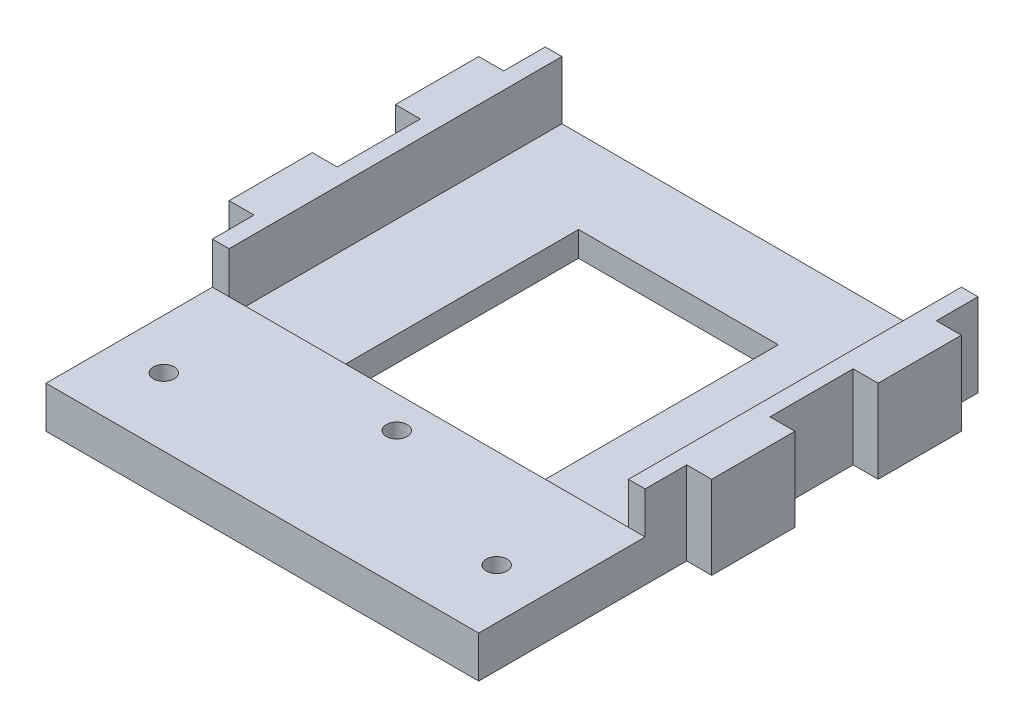
from build123d import *

# Parameters (mm, degrees)
SKETCH1_W               = 52
SKETCH1_H               = 60
BOSS_EXTRUDE1_DEPTH     = 10
CUT_EXTRUDE1_DEPTH      = 5
SKETCH3_R               = 1.25
CUT_EXTRUDE2_DEPTH      = 5
CUT_EXTRUDE3_DEPTH      = 3
SKETCH6_W               = 24
SKETCH6_H               = 30
CUT_EXTRUDE4_DEPTH      = 41.938978981
SKETCH7_W               = 3
SKETCH7_H               = 10
BOSS_EXTRUDE2_DEPTH     = 10
LPATTERN1_COUNT         = 2
LPATTERN1_PITCH         = 20
MIRROR1_COPY_1_SKETCH_W = 3
MIRROR1_COPY_1_SKETCH_H = 10
MIRROR1_COPY_1_DEPTH    = 10
SKETCH8_W               = 48
SKETCH8_H               = 40
CUT_EXTRUDE5_DEPTH      = 2


with BuildPart() as part:
    # Sketch1 → Boss-Extrude1 (new body)
    with BuildSketch(Plane(origin=(0, 0, 0), x_dir=(1, 0, 0), z_dir=(0, 1, 0))):
        Rectangle(SKETCH1_W, SKETCH1_H)
    extrude(amount=BOSS_EXTRUDE1_DEPTH)

    # Sketch2 → Cut-Extrude1 (cut)
    with BuildSketch(Plane(origin=(0, 10, 0), x_dir=(1, 0, 0), z_dir=(0, 1, 0))):
        Polygon((-26, -30), (26, -30), (26, -10), (24, -10), (24, 30), (-24, 30), (-24, -10), (-26, -10), align=None)
    extrude(amount=-CUT_EXTRUDE1_DEPTH, mode=Mode.SUBTRACT)

    # Sketch3 → Cut-Extrude2 (cut)
    with BuildSketch(Plane(origin=(0, 5, 0), x_dir=(1, 0, 0), z_dir=(0, 1, 0))):
        with Locations(Location((-20, -21.847557332, 0), (0, 0, 270))):
            Circle(SKETCH3_R)
        with Locations(Location((0, -13.847557332, 0), (0, 0, 270))):
            Circle(SKETCH3_R)
        with Locations(Location((20, -21.847557332, 0), (0, 0, 270))):
            Circle(SKETCH3_R)
    extrude(amount=-CUT_EXTRUDE2_DEPTH, mode=Mode.SUBTRACT)

    # Sketch5 → Cut-Extrude3 (cut)
    with BuildSketch(Plane.XZ):
        Polygon((-18.375, 24.662139894), (-21.625, 24.662139894), (-23.25, 21.847557332), (-21.625, 19.03297477), (-18.375, 19.03297477), (-16.75, 21.847557332), align=None)
        Polygon((1.625, 16.662139894), (-1.625, 16.662139894), (-3.25, 13.847557332), (-1.625, 11.03297477), (1.625, 11.03297477), (3.25, 13.847557332), align=None)
        Polygon((21.625, 24.662139894), (18.375, 24.662139894), (16.75, 21.847557332), (18.375, 19.03297477), (21.625, 19.03297477), (23.25, 21.847557332), align=None)
    extrude(amount=-CUT_EXTRUDE3_DEPTH, mode=Mode.SUBTRACT)

    # Sketch6 → Cut-Extrude4 (cut, through all)
    with BuildSketch(Plane.XZ):
        with Locations((0, -5)):
            Rectangle(SKETCH6_W, SKETCH6_H)
    extrude(amount=-CUT_EXTRUDE4_DEPTH, mode=Mode.SUBTRACT)

    # Sketch7 → Boss-Extrude2 (add)
    with BuildSketch(Plane(origin=(0, 10, 0), x_dir=(1, 0, 0), z_dir=(0, 1, 0))):
        with Locations((-27.5, 20)):
            Rectangle(SKETCH7_W, SKETCH7_H)
    boss_extrude2 = extrude(amount=-BOSS_EXTRUDE2_DEPTH)

    # LPattern1: Boss-Extrude2 ×2
    with Locations(*[(0, 0, i * LPATTERN1_PITCH) for i in range(1, LPATTERN1_COUNT)]):
        add(boss_extrude2)

    # Mirror1: Boss-Extrude2 across plane
    add(boss_extrude2.mirror(Plane(origin=(0, 0, 0), x_dir=(0, 0, 1), z_dir=(1, 0, 0))))

    # Mirror1 copy 1 sketch → Mirror1 copy 1 (add)
    with BuildSketch(Plane(origin=(0, 10, 20), x_dir=(-1, 0, 0), z_dir=(0, 1, 0))):
        with Locations((-27.5, -20)):
            Rectangle(MIRROR1_COPY_1_SKETCH_W, MIRROR1_COPY_1_SKETCH_H)
    extrude(amount=-MIRROR1_COPY_1_DEPTH)

    # Sketch8 → Cut-Extrude5 (cut)
    with BuildSketch(Plane(origin=(0, 5, 0), x_dir=(1, 0, 0), z_dir=(0, 1, 0))):
        with Locations((0, 10)):
            Rectangle(SKETCH8_W, SKETCH8_H)
    extrude(amount=-CUT_EXTRUDE5_DEPTH, mode=Mode.SUBTRACT)


solid = part.part
